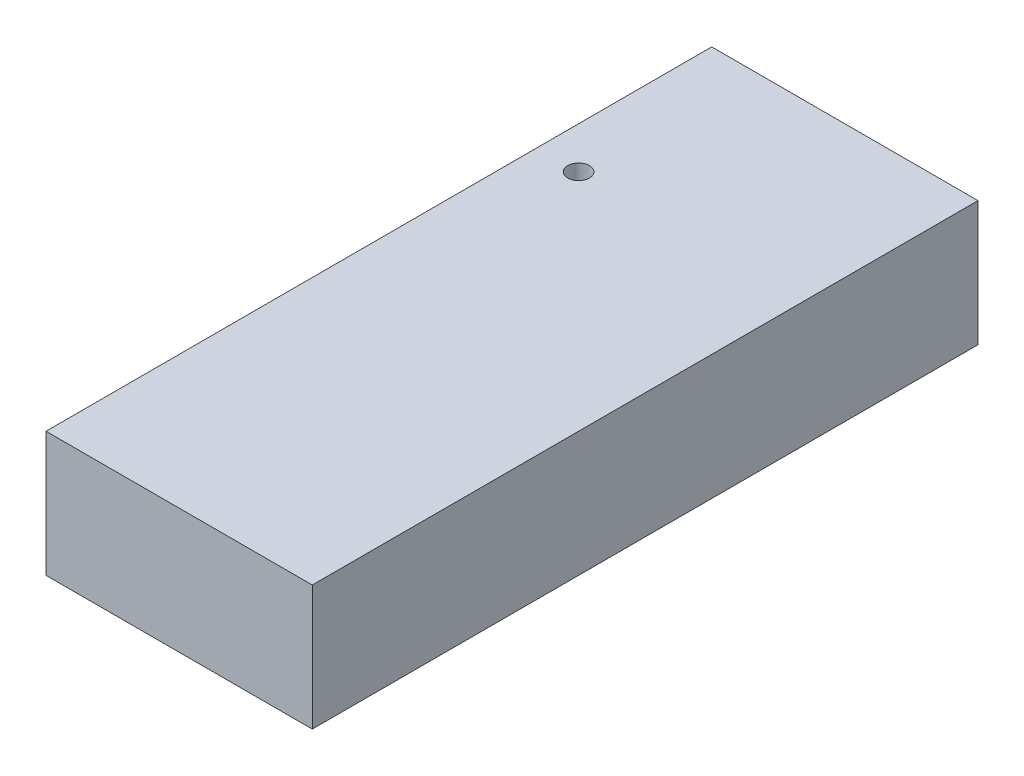
from build123d import *

# Parameters (mm, degrees)
SKETCH1_W           = 20.32
SKETCH1_H           = 50.8
BOSS_EXTRUDE1_DEPTH = 9.525
SKETCH2_R           = 0.8255
CUT_EXTRUDE1_DEPTH  = 56.536186626


with BuildPart() as part:
    # Sketch1 → Boss-Extrude1 (new body)
    with BuildSketch(Plane(origin=(0, 0, 0), x_dir=(1, 0, 0), z_dir=(0, 1, 0))):
        with Locations((10.16, 25.4)):
            Rectangle(SKETCH1_W, SKETCH1_H)
    extrude(amount=BOSS_EXTRUDE1_DEPTH)

    # Sketch2 → Cut-Extrude1 (cut, through all)
    with BuildSketch(Plane(origin=(0, 9.525, 0), x_dir=(1, 0, 0), z_dir=(0, 1, 0))):
        with Locations(Location((3.175, 37.465, 0), (0, 0, 270))):
            Circle(SKETCH2_R)
    extrude(amount=-CUT_EXTRUDE1_DEPTH, mode=Mode.SUBTRACT)


solid = part.part
